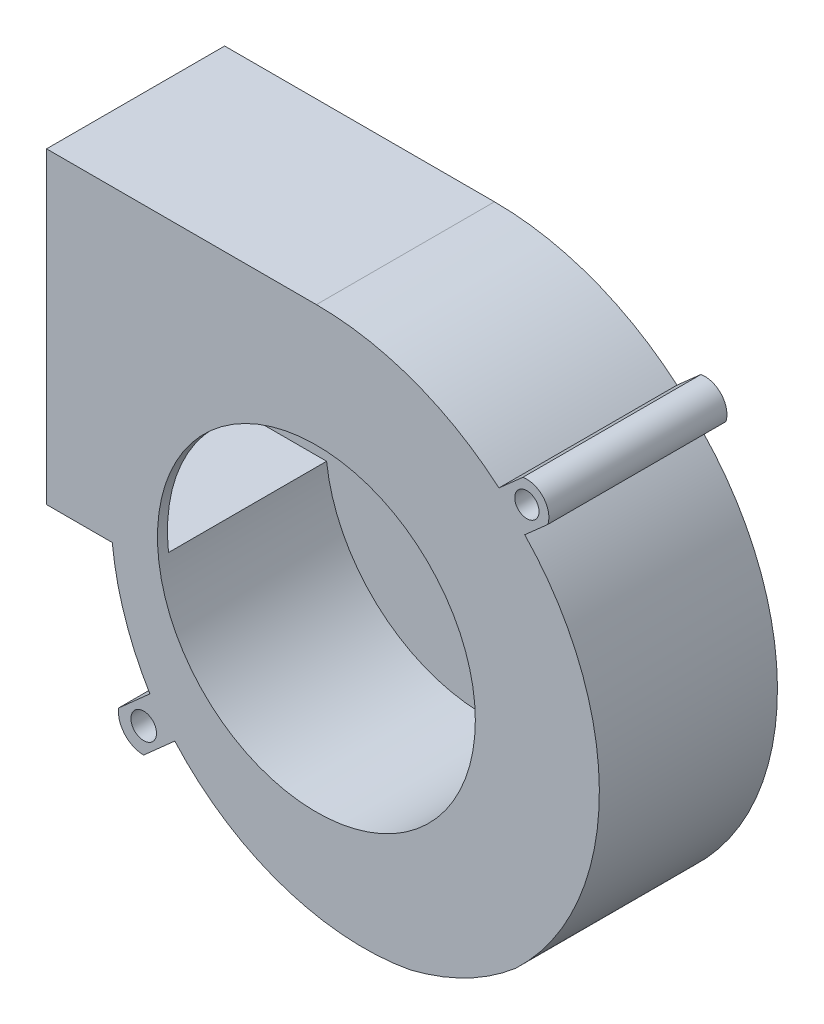
from build123d import *

# Parameters (mm, degrees)
SKETCH1_R           = 2.25
SKETCH1_R_2         = 2.372088477
BOSS_EXTRUDE1_DEPTH = 33
SKETCH2_R           = 29.45
CUT_EXTRUDE1_DEPTH  = 31.15
SKETCH3_W           = 29.3
SKETCH3_H           = 53.492504466
CUT_EXTRUDE2_DEPTH  = 58


with BuildPart() as part:
    # Sketch1 → Boss-Extrude1 (new body)
    with BuildSketch(Plane.XY):
        with BuildLine():
            Line((-67.490537214, -8.925660295), (-67.490537214, -66.018164761))
            Line((-67.490537214, -66.018164761), (-55.315435977, -66.018164761))
            ThreePointArc((-55.315435977, -66.018164761), (-52.985618491, -76.806821645), (-48.344940443, -86.82117505))
            Line((-48.344940443, -86.82117505), (-54.153009969, -91.989482541))
            ThreePointArc((-54.153009969, -91.989482541), (-52.996606833, -95.645534427), (-49.499657733, -97.218852767))
            Line((-49.499657733, -97.218852767), (-43.732472201, -92.086925876))
            ThreePointArc((-43.732472201, -92.086925876), (-23.877416965, -105.274546325), (-0.103624015, -106.99015709))
            ThreePointArc((-0.103624015, -106.99015709), (10.241918426, -103.132381102), (19.415070822, -96.986979642))
            ThreePointArc((19.415070822, -96.986979642), (34.927027694, -62.122719509), (21.114082576, -26.551101781))
            Line((21.114082576, -26.551101781), (25.392497534, -22.761995578))
            ThreePointArc((25.392497534, -22.761995578), (24.56016132, -18.82386048), (20.751489025, -17.521667342))
            Line((20.751489025, -17.521667342), (16.336215646, -21.431979902))
            ThreePointArc((16.336215646, -21.431979902), (0.541775721, -12.152351096), (-17.490537214, -8.925660295))
            Line((-17.490537214, -8.925660295), (-67.490537214, -8.925660295))
        make_face()
        with Locations((21.509462786, -21.525660295)):
            Circle(SKETCH1_R, mode=Mode.SUBTRACT)
        with Locations((-49.490537214, -92.525660295)):
            Circle(SKETCH1_R_2, mode=Mode.SUBTRACT)
    extrude(amount=BOSS_EXTRUDE1_DEPTH)

    # Sketch2 → Cut-Extrude1 (cut)
    with BuildSketch(Plane.XY.offset(33)):
        with Locations((-17.490537214, -60.925660295)):
            Circle(SKETCH2_R)
    extrude(amount=-CUT_EXTRUDE1_DEPTH, mode=Mode.SUBTRACT)

    # Sketch3 → Cut-Extrude2 (cut)
    with BuildSketch(Plane.ZY.offset(67.490537214)):
        with Locations((16.5, -37.521912528)):
            Rectangle(SKETCH3_W, SKETCH3_H)
    extrude(amount=-CUT_EXTRUDE2_DEPTH, mode=Mode.SUBTRACT)


solid = part.part
